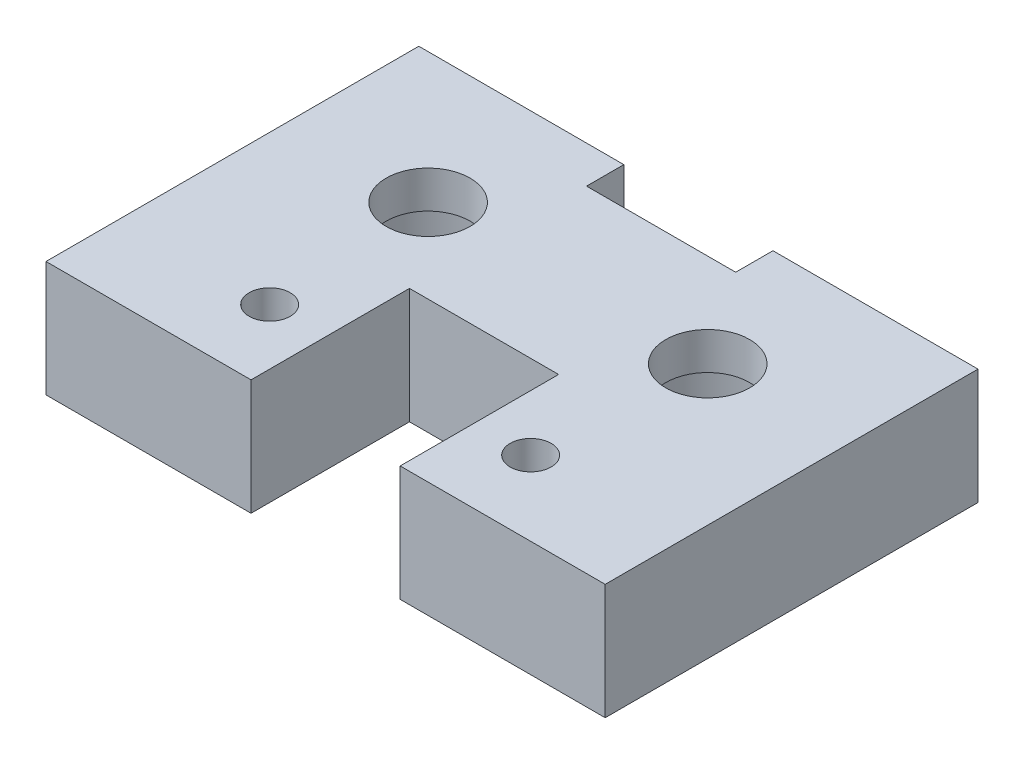
from build123d import *

# Parameters (mm, degrees)
SKETCH_1_W          = 30
SKETCH_1_H          = 20
EXTRUDE_1_DEPTH     = 4.2
SKETCH_2_R          = 4.15
CUT_EXTRUDE_1_DEPTH = 19.510537539
SKETCH_3_W          = 8
SKETCH_3_H          = 8.5
CUT_EXTRUDE_2_DEPTH = 19.510537539
EXTRUDE_2_DEPTH     = 2
SKETCH_5_R          = 2.25
CUT_EXTRUDE_3_DEPTH = 19.510537539
SKETCH_6_W          = 8
SKETCH_6_H          = 2
CUT_EXTRUDE_4_DEPTH = 20.064102392
SKETCH_7_R          = 1.1
CUT_EXTRUDE_5_DEPTH = 20.064102392
SKETCH_8_W          = 2.8
SKETCH_8_H          = 2.8
EXTRUDE_3_DEPTH     = 3


with BuildPart() as part:
    # 草图1 → 凸台-拉伸1 (new body)
    with BuildSketch(Plane(origin=(0, 0, 0), x_dir=(1, 0, 0), z_dir=(0, 1, 0))):
        Rectangle(SKETCH_1_W, SKETCH_1_H)
    extrude(amount=EXTRUDE_1_DEPTH)

    # 草图2 → 切除-拉伸1 (cut, through all)
    with BuildSketch(Plane(origin=(0, 4.2, 0), x_dir=(1, 0, 0), z_dir=(0, 1, 0))):
        with Locations(Location((-7.5, 3, 0), (0, 0, 270))):
            Circle(SKETCH_2_R)
        with Locations(Location((7.5, 3, 0), (0, 0, 270))):
            Circle(SKETCH_2_R)
    extrude(amount=-CUT_EXTRUDE_1_DEPTH, mode=Mode.SUBTRACT)

    # 草图3 → 切除-拉伸2 (cut, through all)
    with BuildSketch(Plane(origin=(0, 4.2, 0), x_dir=(1, 0, 0), z_dir=(0, 1, 0))):
        with Locations((0, -5.75)):
            Rectangle(SKETCH_3_W, SKETCH_3_H)
    extrude(amount=-CUT_EXTRUDE_2_DEPTH, mode=Mode.SUBTRACT)

    # 草图4 → 凸台-拉伸2 (add)
    with BuildSketch(Plane(origin=(0, 4.2, 0), x_dir=(1, 0, 0), z_dir=(0, 1, 0))):
        Polygon((-4, -1.5), (4, -1.5), (4, -10), (15, -10), (15, 10), (-15, 10), (-15, -10), (-4, -10), align=None)
    extrude(amount=EXTRUDE_2_DEPTH)

    # 草图5 → 切除-拉伸3 (cut, through all)
    with BuildSketch(Plane.XZ.offset(-4.2)):
        with Locations(Location((-7.5, -3, 0), (0, 0, 270))):
            Circle(SKETCH_5_R)
        with Locations(Location((7.5, -3, 0), (0, 0, 270))):
            Circle(SKETCH_5_R)
    extrude(amount=-CUT_EXTRUDE_3_DEPTH, mode=Mode.SUBTRACT)

    # 草图6 → 切除-拉伸4 (cut, through all)
    with BuildSketch(Plane(origin=(0, 6.2, 0), x_dir=(1, 0, 0), z_dir=(0, 1, 0))):
        with Locations((0, 9)):
            Rectangle(SKETCH_6_W, SKETCH_6_H)
    extrude(amount=-CUT_EXTRUDE_4_DEPTH, mode=Mode.SUBTRACT)

    # 草图7 → 切除-拉伸5 (cut, through all)
    with BuildSketch(Plane(origin=(0, 6.2, 0), x_dir=(1, 0, 0), z_dir=(0, 1, 0))):
        with Locations(Location((-7, -6, 0), (0, 0, 270))):
            Circle(SKETCH_7_R)
        with Locations(Location((7, -6, 0), (0, 0, 90))):
            Circle(SKETCH_7_R)
    extrude(amount=-CUT_EXTRUDE_5_DEPTH, mode=Mode.SUBTRACT)

    # 草图8 → 凸台-拉伸3 (add)
    with BuildSketch(Plane.XZ):
        with Locations((0, -5)):
            Rectangle(SKETCH_8_W, SKETCH_8_H)
    extrude(amount=EXTRUDE_3_DEPTH)


solid = part.part
